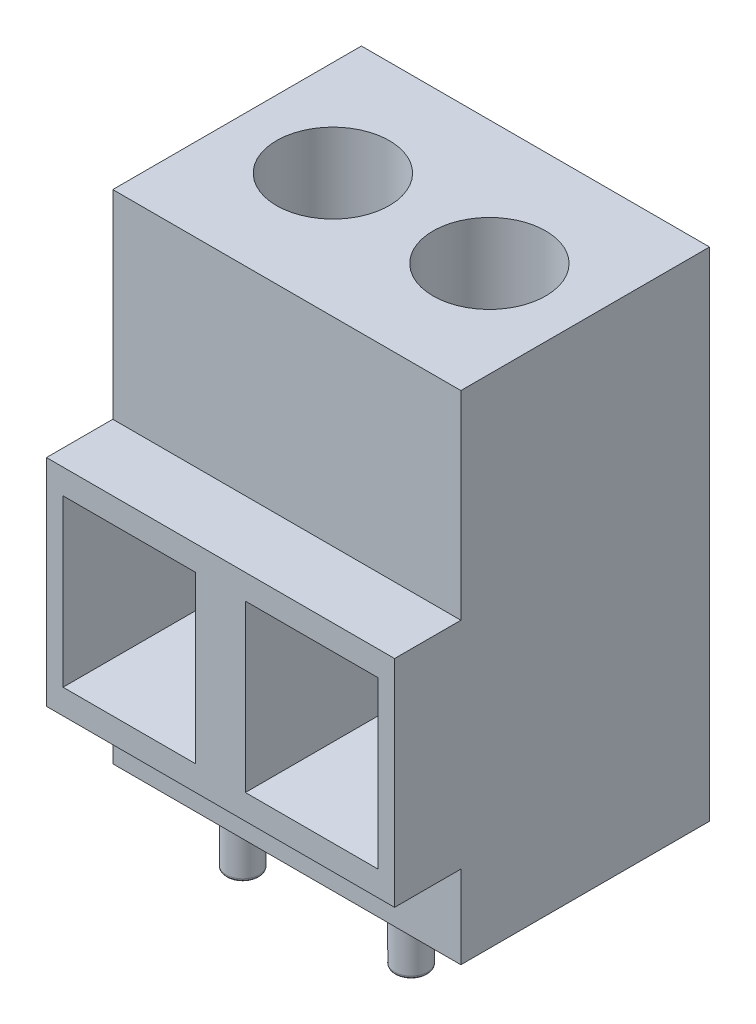
from build123d import *
from build123d.topology import SkipClean

# Parameters (mm, degrees)
SKETCH_1_W                    = 15
SKETCH_1_H                    = 30
SKETCH_1_W_2                  = 4
SKETCH_1_H_2                  = 13
EXTRUDE_1_DEPTH               = 10.5
SKETCH_3_R                    = 3.4
CUT_EXTRUDE_1_DEPTH           = 8
SKETCH_4_W                    = 8
SKETCH_4_H                    = 10
CUT_EXTRUDE_3_DEPTH           = 16
CUT_EXTRUDE_3_DRAFT           = -6
CUT_EXTRUDE_3_PROFILE_2_DEPTH = 16
CUT_EXTRUDE_3_PROFILE_2_DRAFT = -6
CUT_EXTRUDE_5_DEPTH           = 1
CUT_EXTRUDE_6_DEPTH           = 1
SKETCH_9_R                    = 1
EXTRUDE_2_DEPTH               = 4
FILLET_3_R                    = 0.2


with BuildPart() as part:
    # Эскиз1 → Бобышка-Вытянуть1 (new, symmetric)
    with BuildSketch(Plane(origin=(0, 0, 0), x_dir=(0, 0, -1), z_dir=(1, 0, 0))):
        Rectangle(SKETCH_1_W, SKETCH_1_H)
        with Locations((-9.5, -3.5)):
            Rectangle(SKETCH_1_W_2, SKETCH_1_H_2)
    extrude(amount=EXTRUDE_1_DEPTH, both=True)

    # Эскиз3 → Вырез-Вытянуть1 (cut)
    with BuildSketch(Plane(origin=(0, 15, 0), x_dir=(1, 0, 0), z_dir=(0, 1, 0))):
        with Locations(Location((-4.72, 0, 0), (0, 0, 270))):
            Circle(SKETCH_3_R)
        with Locations(Location((4.72, 0, 0), (0, 0, 270))):
            Circle(SKETCH_3_R)
    extrude(amount=-CUT_EXTRUDE_1_DEPTH, mode=Mode.SUBTRACT)


with BuildPart() as cut_extrude_3_tool:
    # Эскиз4 → Вырез-Вытянуть3 (with draft: the straight prism first)
    with BuildSketch(Plane.XY.offset(11.5)):
        with Locations((-5.5, -3.5)):
            Rectangle(SKETCH_4_W, SKETCH_4_H)
    extrude(amount=-CUT_EXTRUDE_3_DEPTH)
    # Вырез-Вытянуть3: the draft: its side faces are tilted about the plane it starts from
    cut_extrude_3_sides = [cut_extrude_3_tool.faces().sort_by_distance(p)[0] for p in [
        (-5.5, -8.5, 3.5),
        (-1.5, -3.5, 3.5),
        (-5.5, 1.5, 3.5),
        (-9.5, -3.5, 3.5),
    ]]
    draft(cut_extrude_3_sides, Plane.XY.offset(11.5), CUT_EXTRUDE_3_DRAFT)


with BuildPart() as part_1:
    add(part.part)

    # Вырез-Вытянуть3: cut by cut_extrude_3_tool
    add(cut_extrude_3_tool.part, mode=Mode.SUBTRACT)


with BuildPart() as cut_extrude_3_profile_2_tool:
    # Эскиз4 → Вырез-Вытянуть3 profile 2 (with draft: the straight prism first)
    with BuildSketch(Plane.XY.offset(11.5)):
        with Locations((5.5, -3.5)):
            Rectangle(SKETCH_4_W, SKETCH_4_H)
    extrude(amount=-CUT_EXTRUDE_3_PROFILE_2_DEPTH)
    # Вырез-Вытянуть3 profile 2: the draft: its side faces are tilted about the plane it starts from
    cut_extrude_3_profile_2_sides = [cut_extrude_3_profile_2_tool.faces().sort_by_distance(p)[0] for p in [
        (5.5, -8.5, 3.5),
        (9.5, -3.5, 3.5),
        (5.5, 1.5, 3.5),
        (1.5, -3.5, 3.5),
    ]]
    draft(cut_extrude_3_profile_2_sides, Plane.XY.offset(11.5), CUT_EXTRUDE_3_PROFILE_2_DRAFT)


with BuildPart() as part_2:
    add(part_1.part)

    # Вырез-Вытянуть3 profile 2: cut by cut_extrude_3_profile_2_tool
    add(cut_extrude_3_profile_2_tool.part, mode=Mode.SUBTRACT)

    # Эскиз7 → Вырез-Вытянуть5 (cut)
    with BuildSketch(Plane(origin=(0, 7, 0), x_dir=(1, 0, 0), z_dir=(0, 1, 0))):
        with BuildLine():
            ThreePointArc((-8.12, 1e-09), (-8.110745992, -0.250682298), (-8.083034344, -0.5))
            Line((-8.083034344, -0.5), (-1.356965656, -0.5))
            ThreePointArc((-1.356965656, -0.5), (-1.329254008, -0.250682299), (-1.32, 0))
            ThreePointArc((-1.32, 0), (-1.329254008, 0.250682299), (-1.356965656, 0.5))
            Line((-1.356965656, 0.5), (-8.083034344, 0.5))
            ThreePointArc((-8.083034344, 0.5), (-8.110745992, 0.250682299), (-8.12, 1e-09))
        make_face()
    extrude(amount=-CUT_EXTRUDE_5_DEPTH, mode=Mode.SUBTRACT)

    # Эскиз8 → Вырез-Вытянуть6 (cut)
    with SkipClean():  # the faces are left unmerged after this step: merging them gives an invalid solid
        with BuildSketch(Plane(origin=(0, 7, 0), x_dir=(1, 0, 0), z_dir=(0, 1, 0))):
            with BuildLine():
                Line((1.356965656, 0.5), (8.083034344, 0.5))
                ThreePointArc((8.083034344, 0.5), (8.12, 0), (8.083034344, -0.5))
                Line((8.083034344, -0.5), (1.356965656, -0.5))
                ThreePointArc((1.356965656, -0.5), (1.32, 0), (1.356965656, 0.5))
            make_face()
        extrude(amount=-CUT_EXTRUDE_6_DEPTH, mode=Mode.SUBTRACT)

    # Эскиз9 → Бобышка-Вытянуть2 (add)
    with SkipClean():  # the faces are left unmerged after this step: merging them gives an invalid solid
        with BuildSketch(Plane.XZ.offset(15)):
            with Locations(Location((-5.08, 5.08, 0), (0, 0, 90))):
                Circle(SKETCH_9_R)
            with Locations(Location((5.08, 5.08, 0), (0, 0, 90))):
                Circle(SKETCH_9_R)
            with Locations(Location((5.08, -5.08, 0), (0, 0, 90))):
                Circle(SKETCH_9_R)
            with Locations(Location((-5.08, -5.08, 0), (0, 0, 90))):
                Circle(SKETCH_9_R)
        extrude(amount=EXTRUDE_2_DEPTH)

    # Скругление3
    fillet_3_edges = [part_2.edges().sort_by_distance(p)[0] for p in [
        (-5.08, -19, -6.08),
        (-5.08, -19, 4.08),
        (5.08, -19, 4.08),
        (5.08, -19, -6.08),
    ]]
    fillet(fillet_3_edges, radius=FILLET_3_R)


solid = part_2.part
